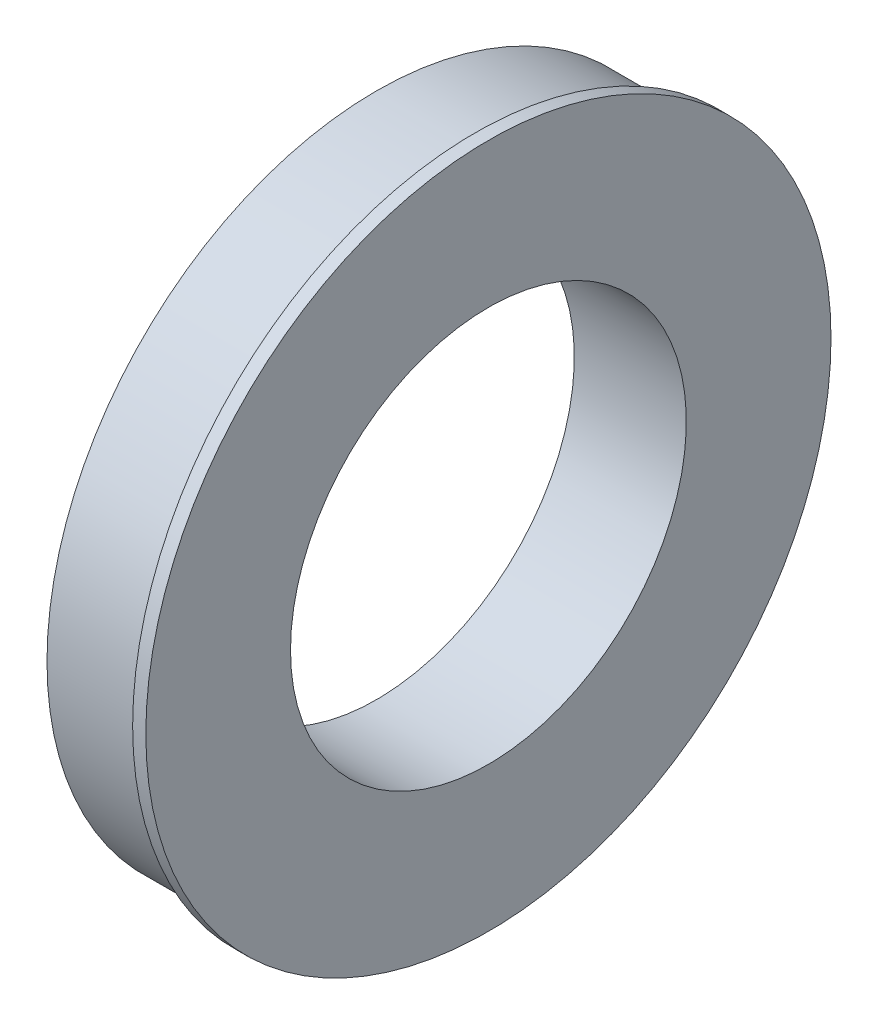
from build123d import *

# Parameters (mm, degrees)
SKETCH2_R           = 63.5
SKETCH2_R_2         = 38.15
BOSS_EXTRUDE1_DEPTH = 19.05
SKETCH3_R           = 66.04
SKETCH3_R_2         = 38.15
BOSS_EXTRUDE4_DEPTH = 2.54


with BuildPart() as part:
    # Sketch2 → Boss-Extrude1 (new body)
    with BuildSketch(Plane(origin=(0, 0, 0), x_dir=(0, 0, -1), z_dir=(1, 0, 0))):
        with Locations(Location((0, 0, 0), (0, 0, 180))):
            Circle(SKETCH2_R)
        with Locations(Location((0, 0, 0), (0, 0, 180))):
            Circle(SKETCH2_R_2, mode=Mode.SUBTRACT)
    extrude(amount=BOSS_EXTRUDE1_DEPTH)

    # Sketch3 → Boss-Extrude4 (add)
    with BuildSketch(Plane(origin=(19.05, 0, 0), x_dir=(0, 0, -1), z_dir=(1, 0, 0))):
        Circle(SKETCH3_R)
        with Locations(Location((0, 0, 0), (0, 0, 180))):
            Circle(SKETCH3_R_2, mode=Mode.SUBTRACT)
    extrude(amount=BOSS_EXTRUDE4_DEPTH)


solid = part.part
